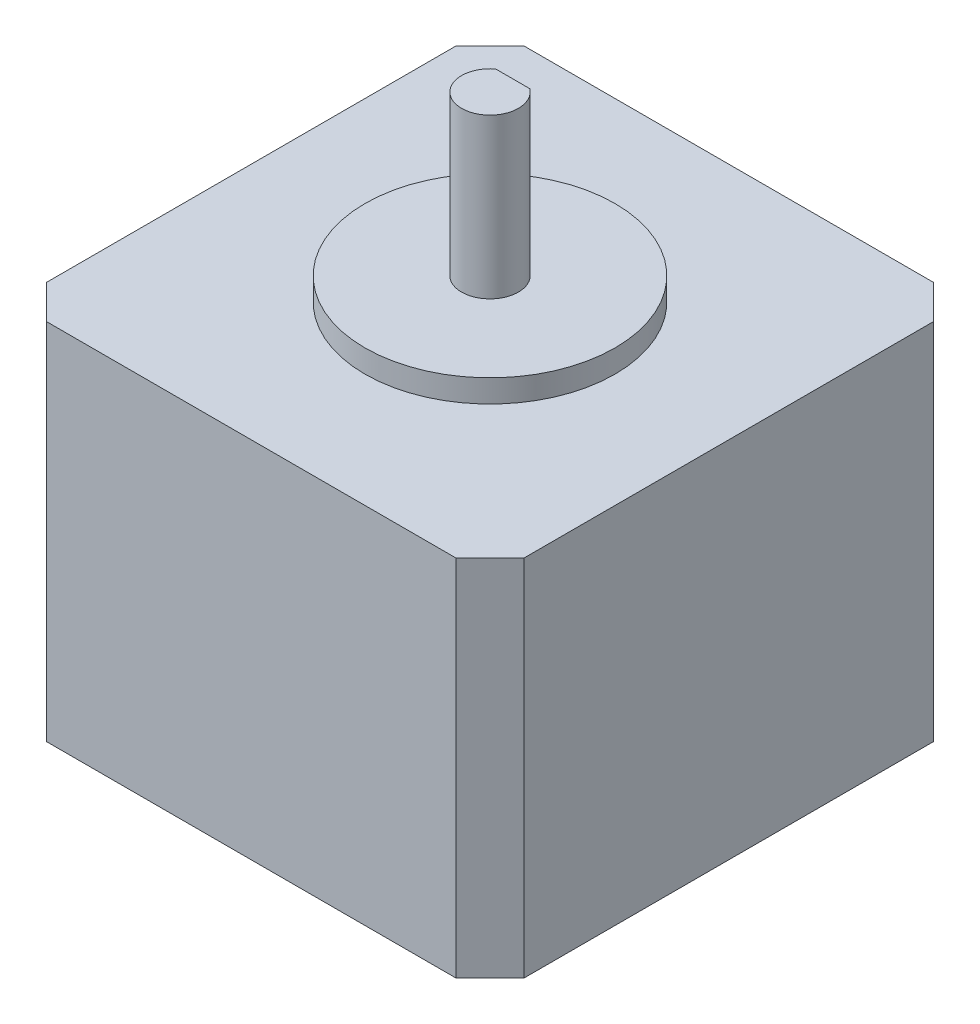
from build123d import *

# Parameters (mm, degrees)
BOSS_EXTRUDE1_DEPTH = 32
SKETCH2_R           = 11
BOSS_EXTRUDE2_DEPTH = 2
BOSS_EXTRUDE3_DEPTH = 14


with BuildPart() as part:
    # Sketch1 → Boss-Extrude1 (new body)
    with BuildSketch(Plane(origin=(0, 0, 0), x_dir=(1, 0, 0), z_dir=(0, 1, 0))):
        Polygon((-18, 21), (-21, 18), (-21, -18), (-18, -21), (18, -21), (21, -18), (21, 18), (18, 21), align=None)
    extrude(amount=BOSS_EXTRUDE1_DEPTH)

    # Sketch2 → Boss-Extrude2 (add)
    with BuildSketch(Plane(origin=(0, 32, 0), x_dir=(1, 0, 0), z_dir=(0, 1, 0))):
        with Locations(Location((0, 0, 0), (0, 0, 270))):
            Circle(SKETCH2_R)
    extrude(amount=BOSS_EXTRUDE2_DEPTH)

    # Sketch3 → Boss-Extrude3 (add)
    with BuildSketch(Plane(origin=(0, 34, 0), x_dir=(1, 0, 0), z_dir=(0, 1, 0))):
        with BuildLine():
            Line((-1.5, 2), (1.5, 2))
            ThreePointArc((1.5, 2), (0, -2.5), (-1.5, 2))
        make_face()
    extrude(amount=BOSS_EXTRUDE3_DEPTH)


solid = part.part
